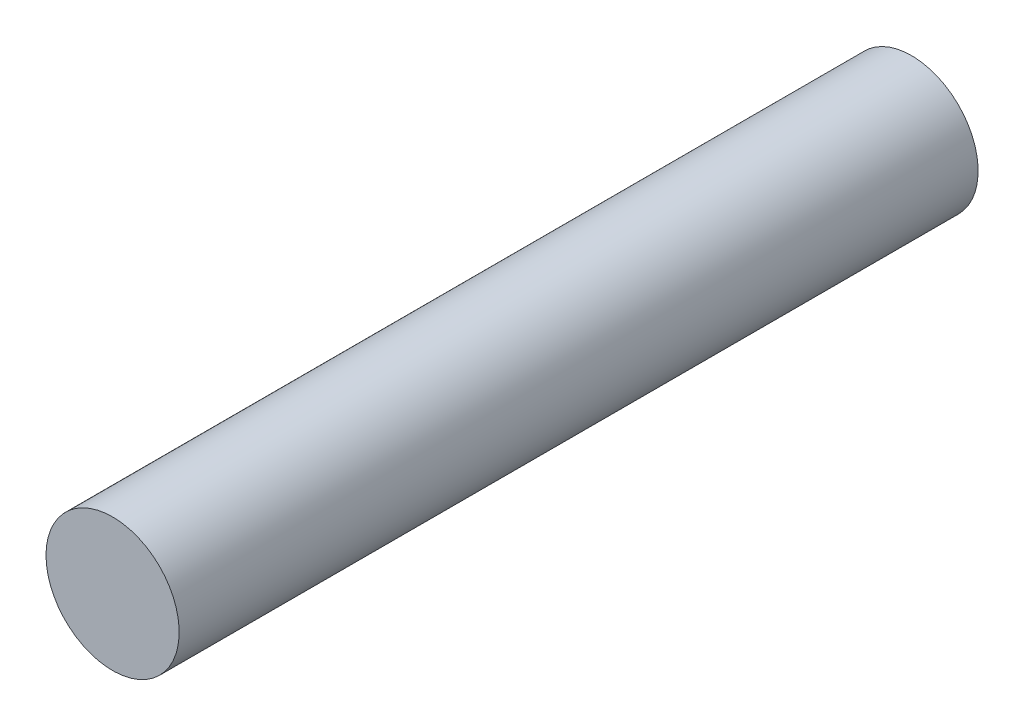
from build123d import *

# Parameters (mm, degrees)
SKETCH1_R           = 6.35
BOSS_EXTRUDE1_DEPTH = 76.2


with BuildPart() as part:
    # Sketch1 → Boss-Extrude1 (new body)
    with BuildSketch(Plane.XY):
        with Locations(Location((0, 0, 0), (0, 0, 180))):
            Circle(SKETCH1_R)
    extrude(amount=BOSS_EXTRUDE1_DEPTH)


solid = part.part
